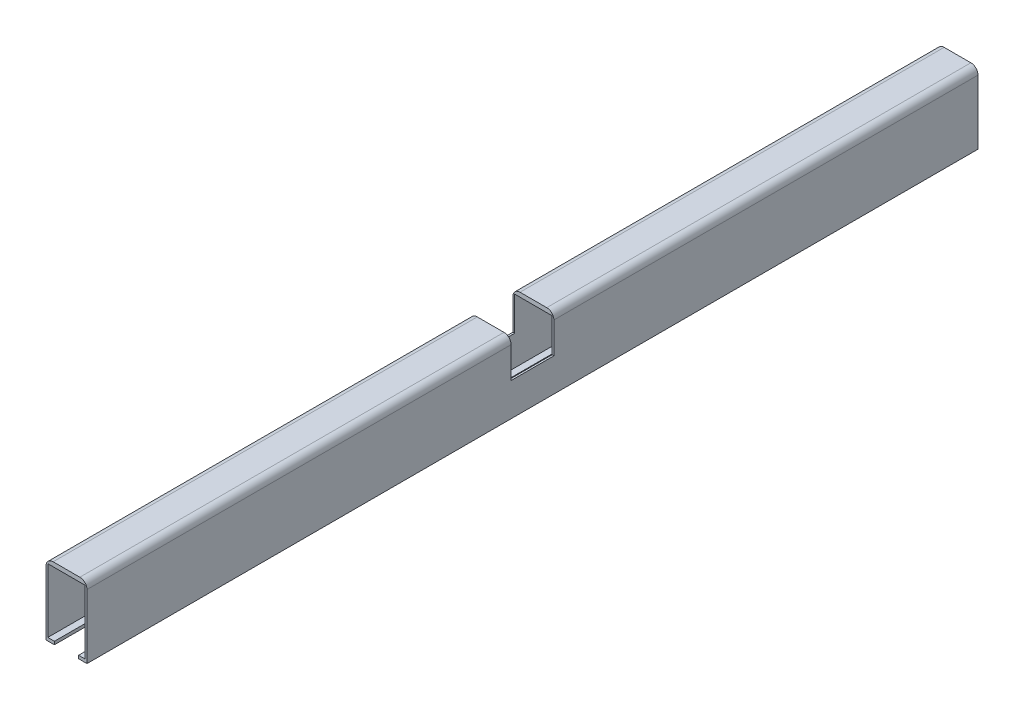
from build123d import *

# Parameters (mm, degrees)
BOSS_EXTRUDE1_DEPTH            = 250
CUT_EXTRUDE1_REACH             = 255.441
SKETCH2_W                      = 24
SKETCH2_H                      = 21.42
CUT_EXTRUDE1_DIRECTION_2_REACH = 255.441


with BuildPart() as part:
    # Sketch1 → Boss-Extrude1 (new, symmetric)
    with BuildSketch(Plane.XY):
        with BuildLine():
            Line((6.785, 0), (6.785, 1.73))
            Line((6.785, 1.73), (10.485, 1.73))
            Line((10.485, 1.73), (10.485, 37.58))
            Line((10.485, 37.58), (-10.485, 37.58))
            Line((-10.485, 37.58), (-10.485, 1.73))
            Line((-10.485, 1.73), (-6.785, 1.73))
            Line((-6.785, 1.73), (-6.785, 0))
            Line((-6.785, 0), (-11.5, 0))
            Line((-11.5, 0), (-11.5, 36))
            ThreePointArc((-11.5, 36), (-10.328427125, 38.828427125), (-7.5, 40))
            Line((-7.5, 40), (7.5, 40))
            ThreePointArc((7.5, 40), (10.328427125, 38.828427125), (11.5, 36))
            Line((11.5, 36), (11.5, 0))
            Line((11.5, 0), (6.785, 0))
        make_face()
    extrude(amount=BOSS_EXTRUDE1_DEPTH, both=True)

    # Sketch2 → Cut-Extrude1 (cut, up to next)
    with BuildSketch(Plane(origin=(0, 0, 0), x_dir=(0, 0, -1), z_dir=(1, 0, 0)), mode=Mode.PRIVATE) as cut_extrude1_sk1:
        with Locations((0, 29.29)):
            Rectangle(SKETCH2_W, SKETCH2_H)
    cut_extrude1_tool1 = extrude(cut_extrude1_sk1.sketch, amount=-CUT_EXTRUDE1_REACH, mode=Mode.PRIVATE) & part.part
    add(cut_extrude1_tool1.solids().sort_by_distance((0, 29.29, 0))[0], mode=Mode.SUBTRACT)

    # Sketch2 → Cut-Extrude1 direction 2 (cut, up to next)
    with BuildSketch(Plane(origin=(0, 0, 0), x_dir=(0, 0, -1), z_dir=(1, 0, 0)), mode=Mode.PRIVATE) as cut_extrude1_direction_2_sk1:
        with Locations((0, 29.29)):
            Rectangle(SKETCH2_W, SKETCH2_H)
    cut_extrude1_direction_2_tool1 = extrude(cut_extrude1_direction_2_sk1.sketch, amount=CUT_EXTRUDE1_DIRECTION_2_REACH, mode=Mode.PRIVATE) & part.part
    add(cut_extrude1_direction_2_tool1.solids().sort_by_distance((0, 29.29, 0))[0], mode=Mode.SUBTRACT)


solid = part.part
